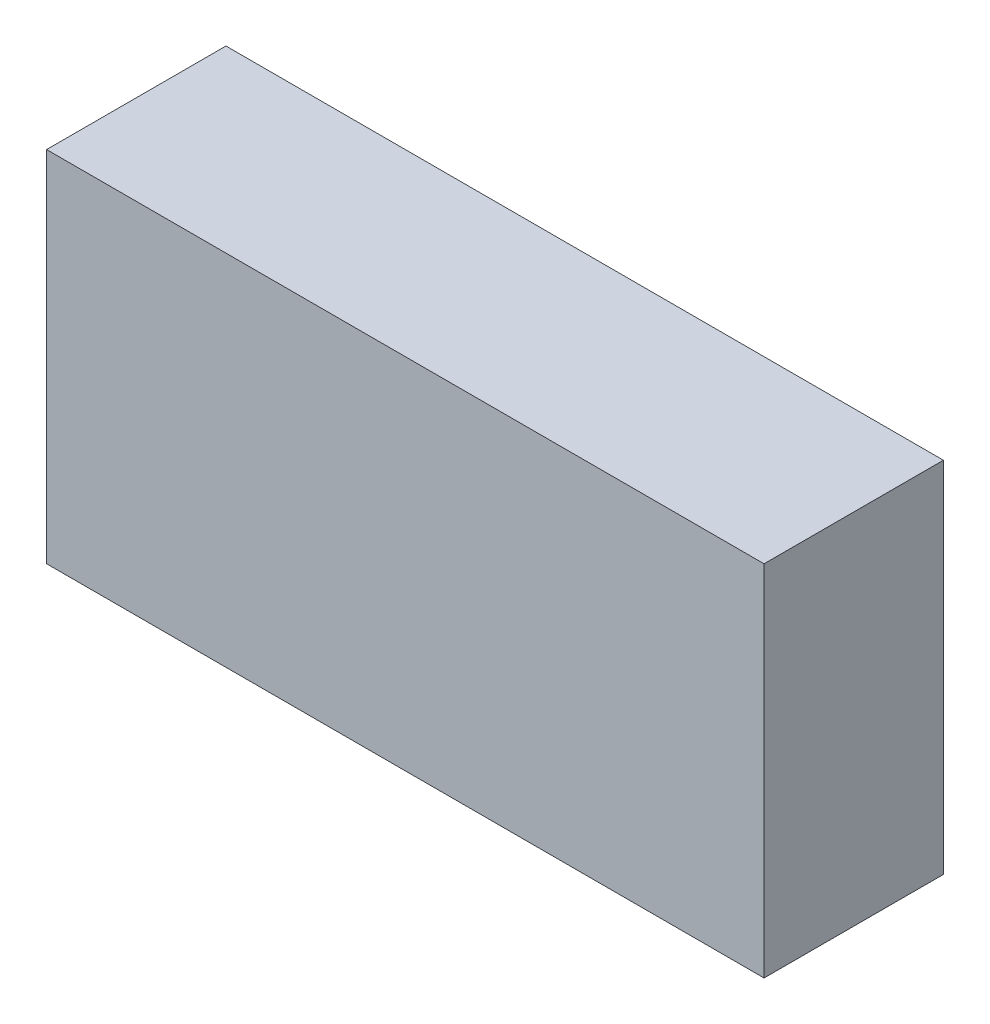
from build123d import *

# Parameters (mm, degrees)
SKETCH_1_W      = 100
SKETCH_1_H      = 25
EXTRUDE_1_DEPTH = 50


with BuildPart() as part:
    # 草图1 → 凸台-拉伸1 (new body)
    with BuildSketch(Plane(origin=(0, 0, 0), x_dir=(1, 0, 0), z_dir=(0, 1, 0))):
        Rectangle(SKETCH_1_W, SKETCH_1_H)
    extrude(amount=EXTRUDE_1_DEPTH)


solid = part.part
